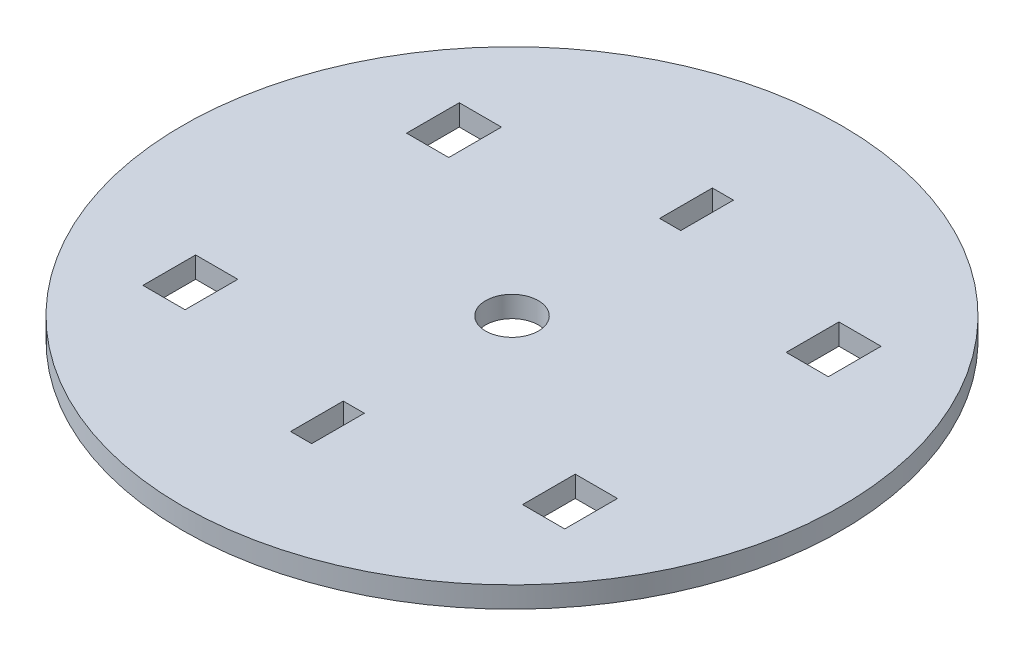
from build123d import *

# Parameters (mm, degrees)
SKETCH1_R            = 125
SKETCH1_R_2          = 10
BOSS_EXTRUDE1_DEPTH  = 8
SKETCH2_W            = 16
SKETCH2_H            = 20
CUT_EXTRUDE1_DEPTH   = 10
LPATTERN1_COUNT      = 2
LPATTERN1_PITCH      = 144
LPATTERN1_COUNT_DIR2 = 2
LPATTERN1_PITCH_DIR2 = 100
SKETCH3_W            = 8
SKETCH3_H            = 20
CUT_EXTRUDE2_DEPTH   = 8


with BuildPart() as part:
    # Sketch1 → Boss-Extrude1 (new body)
    with BuildSketch(Plane(origin=(0, 0, 0), x_dir=(1, 0, 0), z_dir=(0, 1, 0))):
        with Locations(Location((0, 0, 0), (0, 0, 270))):
            Circle(SKETCH1_R)
        with Locations(Location((0, 0, 0), (0, 0, 270))):
            Circle(SKETCH1_R_2, mode=Mode.SUBTRACT)
    extrude(amount=BOSS_EXTRUDE1_DEPTH)

    # Sketch2 → Cut-Extrude1 (cut)
    with BuildSketch(Plane(origin=(0, 8, 0), x_dir=(1, 0, 0), z_dir=(0, 1, 0))):
        with Locations((-72, 50)):
            Rectangle(SKETCH2_W, SKETCH2_H)
    cut_extrude1 = extrude(amount=-CUT_EXTRUDE1_DEPTH, mode=Mode.SUBTRACT)

    # LPattern1: Cut-Extrude1 2 × 2
    with Locations(*[(i * LPATTERN1_PITCH, 0, j * LPATTERN1_PITCH_DIR2) for i in range(LPATTERN1_COUNT) for j in range(LPATTERN1_COUNT_DIR2) if (i, j) != (0, 0)]):
        add(cut_extrude1, mode=Mode.SUBTRACT)

    # Sketch3 → Cut-Extrude2 (cut)
    with BuildSketch(Plane(origin=(0, 8, 0), x_dir=(1, 0, 0), z_dir=(0, 1, 0))):
        with Locations((0, 70)):
            Rectangle(SKETCH3_W, SKETCH3_H)
    cut_extrude2 = extrude(amount=-CUT_EXTRUDE2_DEPTH, mode=Mode.SUBTRACT)

    # Mirror1: Cut-Extrude2 across plane
    add(cut_extrude2.mirror(Plane.XY), mode=Mode.SUBTRACT)


solid = part.part
